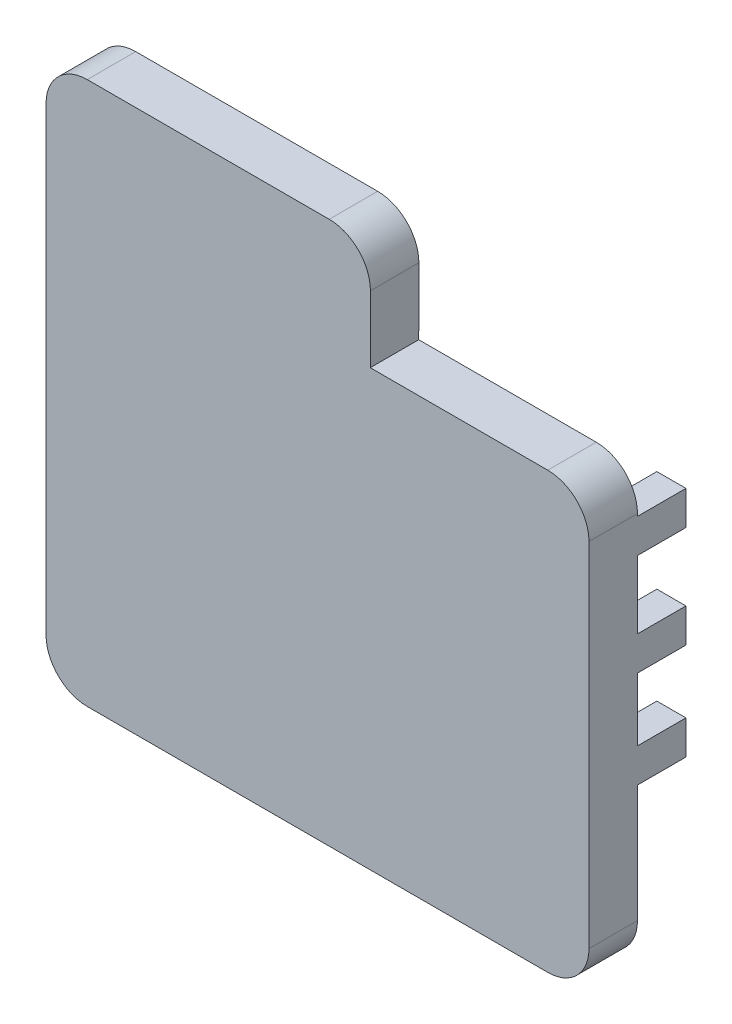
from build123d import *

# Parameters (mm, degrees)
BOSS_EXTRUDE1_DEPTH = 10
SKETCH1_4_W         = 6
SKETCH1_4_H         = 7
BOSS_EXTRUDE2_DEPTH = 10


with BuildPart() as part:
    # Sketch1 → Boss-Extrude1 (new body)
    with BuildSketch(Plane.XY):
        with BuildLine():
            ThreePointArc((88.477222474, 144.232885516), (85.987630114, 150.243293156), (79.977222474, 152.732885516))
            Line((79.977222474, 152.732885516), (43.355273195, 152.732885516))
            Line((43.355273195, 152.732885516), (43.387199595, 166.493163991))
            ThreePointArc((43.387199595, 166.493163991), (40.904598686, 172.516316495), (34.887222474, 175.012885516))
            Line((34.887222474, 175.012885516), (-15.022777526, 175.012885516))
            ThreePointArc((-15.022777526, 175.012885516), (-21.033185166, 172.523293156), (-23.522777526, 166.512885516))
            Line((-23.522777526, 166.512885516), (-23.522777526, 71.512885516))
            ThreePointArc((-23.522777526, 71.512885516), (-21.033185166, 65.502477876), (-15.022777526, 63.012885516))
            Line((-15.022777526, 63.012885516), (79.977222474, 63.012885516))
            ThreePointArc((79.977222474, 63.012885516), (85.987630114, 65.502477876), (88.477222474, 71.512885516))
            Line((88.477222474, 71.512885516), (88.477222474, 144.232885516))
        make_face()
    extrude(amount=BOSS_EXTRUDE1_DEPTH)

    # Sketch1<4> → Boss-Extrude2 (add)
    with BuildSketch(Plane.XY):
        with Locations((85.477222474, 140.232885516)):
            Rectangle(SKETCH1_4_W, SKETCH1_4_H)
        with Locations((85.477222474, 119.232885516)):
            Rectangle(SKETCH1_4_W, SKETCH1_4_H)
        with Locations((85.477222474, 99.232885516)):
            Rectangle(SKETCH1_4_W, SKETCH1_4_H)
        with Locations((-20.522777526, 137.512885516)):
            Rectangle(SKETCH1_4_W, SKETCH1_4_H)
        with Locations((-20.522777526, 101.012885516)):
            Rectangle(SKETCH1_4_W, SKETCH1_4_H)
    extrude(amount=-BOSS_EXTRUDE2_DEPTH)


solid = part.part
